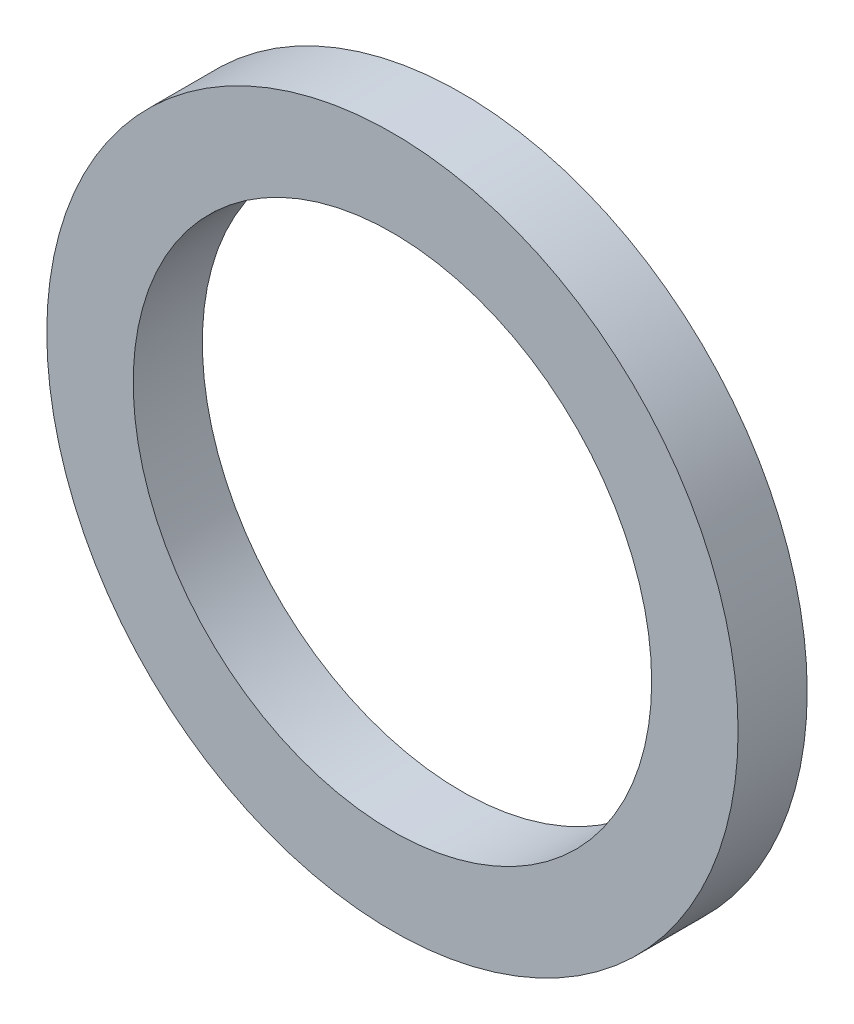
from build123d import *

# Parameters (mm, degrees)
SKICA1_R                = 4
SKICA1_R_2              = 3
P_IDAT_VYSUNUT_M1_DEPTH = 0.8


with BuildPart() as part:
    # Skica1 → Přidat vysunutím1 (new body)
    with BuildSketch(Plane.XY):
        Circle(SKICA1_R)
        Circle(SKICA1_R_2, mode=Mode.SUBTRACT)
    extrude(amount=P_IDAT_VYSUNUT_M1_DEPTH)


solid = part.part
